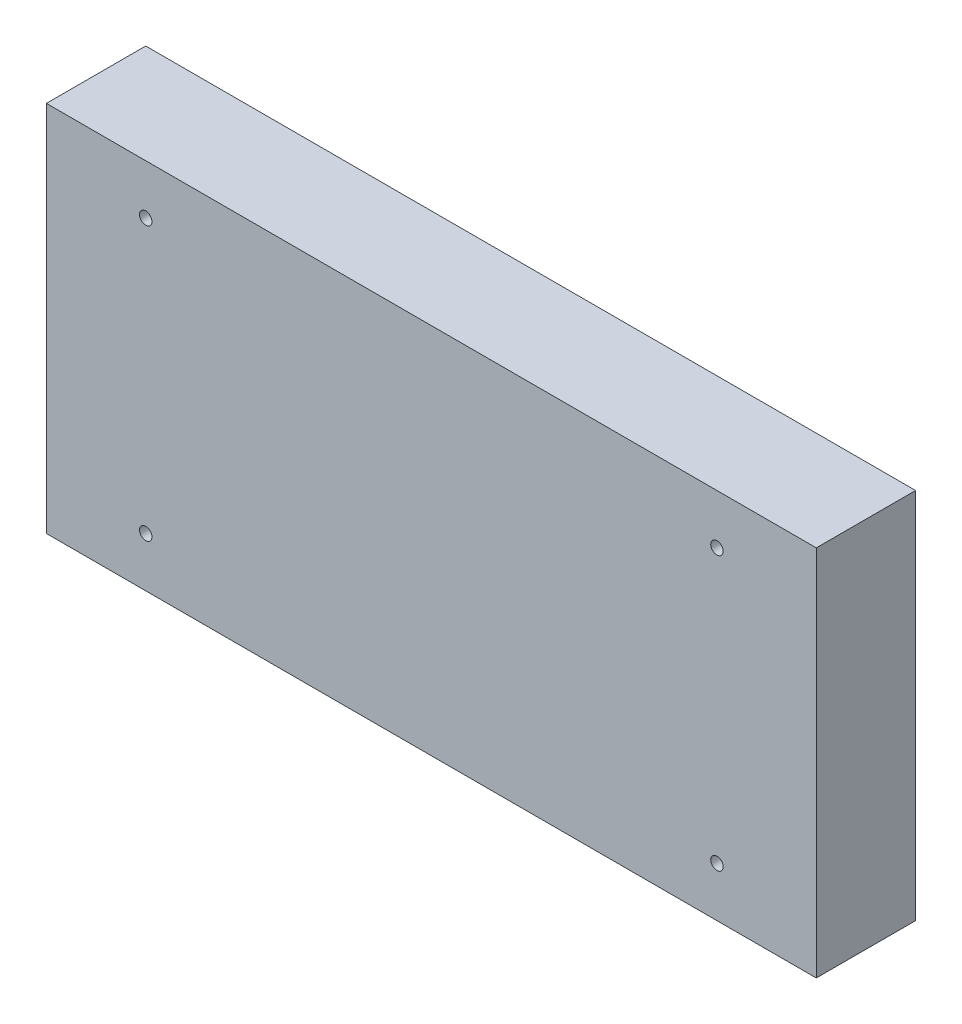
from build123d import *

# Parameters (mm, degrees)
ESQUISSE1_W             = 62
ESQUISSE1_H             = 30
BOSS_EXTRU_1_DEPTH      = 8
ESQUISSE2_R             = 0.5
ENL_V_MAT_EXTRU_1_DEPTH = 10


with BuildPart() as part:
    # Esquisse1 → Boss.-Extru.1 (new body)
    with BuildSketch(Plane.XY):
        with Locations((-5.597042592, -12.882819905)):
            Rectangle(ESQUISSE1_W, ESQUISSE1_H)
    extrude(amount=BOSS_EXTRU_1_DEPTH)

    # Esquisse2 → Enlèv. mat.-Extru.1 (cut)
    with BuildSketch(Plane.XY.offset(8)):
        with Locations((-28.597042592, -1.882819905)):
            Circle(ESQUISSE2_R)
        with Locations((-28.597042592, -23.882819905)):
            Circle(ESQUISSE2_R)
        with Locations((17.402957408, -1.882819905)):
            Circle(ESQUISSE2_R)
        with Locations((17.402957408, -23.882819905)):
            Circle(ESQUISSE2_R)
    extrude(amount=-ENL_V_MAT_EXTRU_1_DEPTH, mode=Mode.SUBTRACT)


solid = part.part
